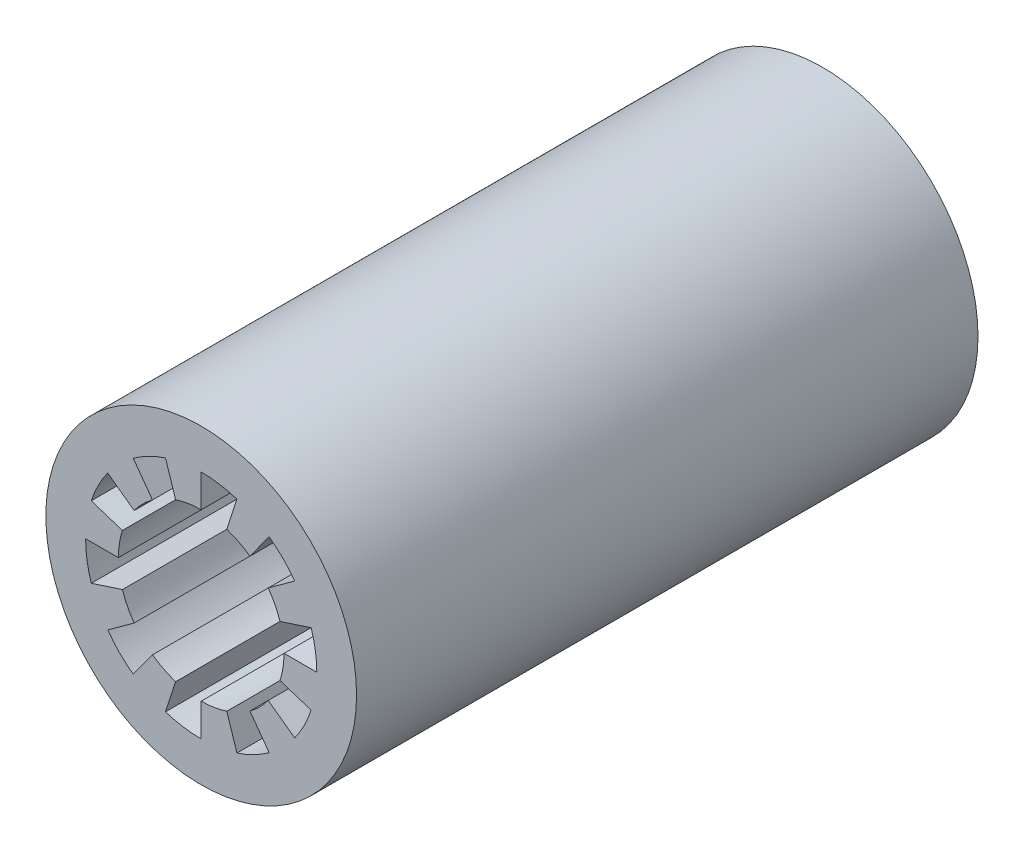
from build123d import *

# Parameters (mm, degrees)
SKETCH_1_R      = 7.5
EXTRUDE_1_DEPTH = 30


with BuildPart() as part:
    # Эскиз1 → Бобышка-Вытянуть1 (new body)
    with BuildSketch(Plane.XY):
        Circle(SKETCH_1_R)
        with BuildLine():
            Line((0, 5.579989869), (0, 4))
            ThreePointArc((0, 4), (-0.62573786, 3.950753362), (-1.236067977, 3.804226065))
            Line((-1.236067977, 3.804226065), (-1.724311698, 5.306885726))
            ThreePointArc((-1.724311698, 5.306885726), (-2.533262389, 4.971807378), (-3.279835753, 4.514306633))
            Line((-3.279835753, 4.514306633), (-2.351141009, 3.236067977))
            ThreePointArc((-2.351141009, 3.236067977), (-2.828427125, 2.828427125), (-3.236067977, 2.351141009))
            Line((-3.236067977, 2.351141009), (-4.514306633, 3.279835753))
            ThreePointArc((-4.514306633, 3.279835753), (-4.971807378, 2.533262389), (-5.306885726, 1.724311698))
            Line((-5.306885726, 1.724311698), (-3.804226065, 1.236067977))
            ThreePointArc((-3.804226065, 1.236067977), (-3.950753362, 0.62573786), (-4, 0))
            Line((-4, 0), (-5.579989869, 0))
            ThreePointArc((-5.579989869, 0), (-5.511290934, -0.87290273), (-5.306885726, -1.724311698))
            Line((-5.306885726, -1.724311698), (-3.804226065, -1.236067977))
            ThreePointArc((-3.804226065, -1.236067977), (-3.564026097, -1.815961999), (-3.236067977, -2.351141009))
            Line((-3.236067977, -2.351141009), (-4.514306633, -3.279835753))
            ThreePointArc((-4.514306633, -3.279835753), (-3.945648675, -3.945648675), (-3.279835753, -4.514306633))
            Line((-3.279835753, -4.514306633), (-2.351141009, -3.236067977))
            ThreePointArc((-2.351141009, -3.236067977), (-1.815961999, -3.564026097), (-1.236067977, -3.804226065))
            Line((-1.236067977, -3.804226065), (-1.724311698, -5.306885726))
            ThreePointArc((-1.724311698, -5.306885726), (-0.87290273, -5.511290934), (0, -5.579989869))
            Line((0, -5.579989869), (0, -4))
            ThreePointArc((0, -4), (0.62573786, -3.950753362), (1.236067977, -3.804226065))
            Line((1.236067977, -3.804226065), (1.724311698, -5.306885726))
            ThreePointArc((1.724311698, -5.306885726), (2.533262389, -4.971807378), (3.279835753, -4.514306633))
            Line((3.279835753, -4.514306633), (2.351141009, -3.236067977))
            ThreePointArc((2.351141009, -3.236067977), (2.828427125, -2.828427125), (3.236067977, -2.351141009))
            Line((3.236067977, -2.351141009), (4.514306633, -3.279835753))
            ThreePointArc((4.514306633, -3.279835753), (4.971807378, -2.533262389), (5.306885726, -1.724311698))
            Line((5.306885726, -1.724311698), (3.804226065, -1.236067977))
            ThreePointArc((3.804226065, -1.236067977), (3.950753362, -0.62573786), (4, 0))
            Line((4, 0), (5.579989869, 0))
            ThreePointArc((5.579989869, 0), (5.511290934, 0.87290273), (5.306885726, 1.724311698))
            Line((5.306885726, 1.724311698), (3.804226065, 1.236067977))
            ThreePointArc((3.804226065, 1.236067977), (3.564026097, 1.815961999), (3.236067977, 2.351141009))
            Line((3.236067977, 2.351141009), (4.514306633, 3.279835753))
            ThreePointArc((4.514306633, 3.279835753), (3.945648675, 3.945648675), (3.279835753, 4.514306633))
            Line((3.279835753, 4.514306633), (2.351141009, 3.236067977))
            ThreePointArc((2.351141009, 3.236067977), (1.815961999, 3.564026097), (1.236067977, 3.804226065))
            Line((1.236067977, 3.804226065), (1.724311698, 5.306885726))
            ThreePointArc((1.724311698, 5.306885726), (0.87290273, 5.511290934), (0, 5.579989869))
        make_face(mode=Mode.SUBTRACT)
    extrude(amount=EXTRUDE_1_DEPTH)


solid = part.part
